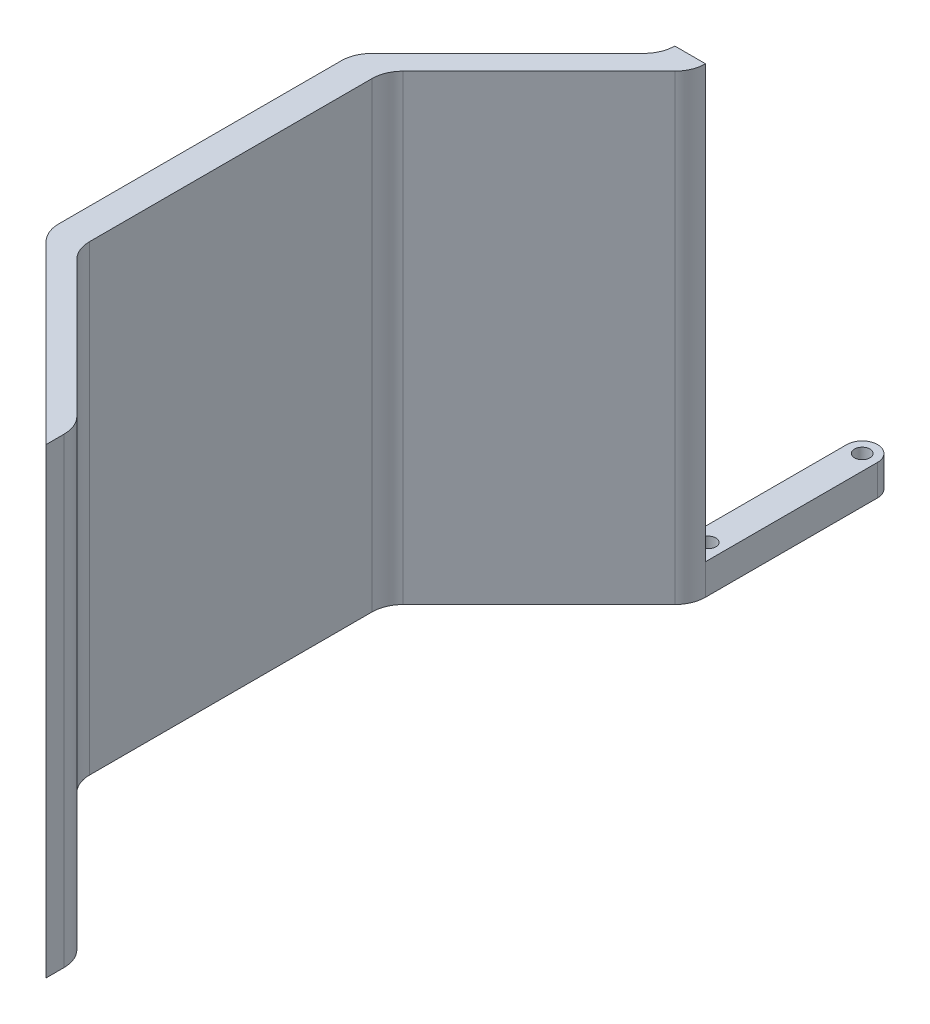
from build123d import *

# Parameters (mm, degrees)
EXTRUDE_1_DEPTH     = 150
CUT_EXTRUDE_START   = -140
CUT_EXTRUDE_2_DEPTH = 140
SKETCH_4_R          = 2.5
CUT_EXTRUDE_3_DEPTH = 302.021089881


with BuildPart() as part:
    # 草图1 → 凸台-拉伸1 (new body)
    with BuildSketch(Plane(origin=(0, 0, 0), x_dir=(1, 0, 0), z_dir=(0, 1, 0))):
        with BuildLine():
            ThreePointArc((-83.929371052, 45.998615801), (-78.929371052, 50.998615801), (-73.929371052, 45.998615801))
            Line((-73.929371052, 45.998615801), (-73.929371052, -4.001384199))
            Line((-73.929371052, -4.001384199), (-73.929371052, -9.859248575))
            ThreePointArc((-73.929371052, -9.859248575), (-74.690575727, -13.686082899), (-76.85830324, -16.930316387))
            Line((-76.85830324, -16.930316387), (-121.000438864, -61.072452011))
            ThreePointArc((-121.000438864, -61.072452011), (-123.168166377, -64.316685499), (-123.929371052, -68.143519823))
            Line((-123.929371052, -68.143519823), (-123.929371052, -159.859248575))
            ThreePointArc((-123.929371052, -159.859248575), (-123.168166377, -163.686082899), (-121.000438864, -166.930316387))
            Line((-121.000438864, -166.930316387), (-76.85830324, -211.072452011))
            ThreePointArc((-76.85830324, -211.072452011), (-74.690575727, -214.316685499), (-73.929371052, -218.143519823))
            Line((-73.929371052, -218.143519823), (-73.929371052, -224.001384199))
            Line((-73.929371052, -224.001384199), (-131.000438864, -166.930316387))
            ThreePointArc((-131.000438864, -166.930316387), (-133.168166377, -163.686082899), (-133.929371052, -159.859248575))
            Line((-133.929371052, -159.859248575), (-133.929371052, -68.143519823))
            ThreePointArc((-133.929371052, -68.143519823), (-133.168166377, -64.316685499), (-131.000438864, -61.072452011))
            Line((-131.000438864, -61.072452011), (-86.85830324, -16.930316387))
            ThreePointArc((-86.85830324, -16.930316387), (-84.690575727, -13.686082899), (-83.929371052, -9.859248575))
            Line((-83.929371052, -9.859248575), (-83.929371052, -4.001384199))
            Line((-83.929371052, -4.001384199), (-83.929371052, 45.998615801))
        make_face()
    extrude(amount=EXTRUDE_1_DEPTH)

    # 草图3 → 切除-拉伸2 (cut)
    with BuildSketch(Plane(origin=(0, 150, 0), x_dir=(1, 0, 0), z_dir=(0, 1, 0)).offset(CUT_EXTRUDE_START)):
        with BuildLine():
            Line((-83.929371052, -9.859248575), (-73.929371052, -9.859248575))
            Line((-73.929371052, -9.859248575), (-73.929371052, 45.998615801))
            ThreePointArc((-73.929371052, 45.998615801), (-78.929371052, 50.998615801), (-83.929371052, 45.998615801))
            Line((-83.929371052, 45.998615801), (-83.929371052, -9.859248575))
        make_face()
    extrude(amount=CUT_EXTRUDE_2_DEPTH, mode=Mode.SUBTRACT)

    # 草图4 → 切除-拉伸3 (cut, through all)
    with BuildSketch(Plane.XZ):
        with Locations(Location((-78.929371052, -45.998615801, 0), (0, 0, 270))):
            Circle(SKETCH_4_R)
        with Locations(Location((-78.929371052, 4.001384199, 0), (0, 0, 270))):
            Circle(SKETCH_4_R)
    extrude(amount=-CUT_EXTRUDE_3_DEPTH, mode=Mode.SUBTRACT)


solid = part.part
